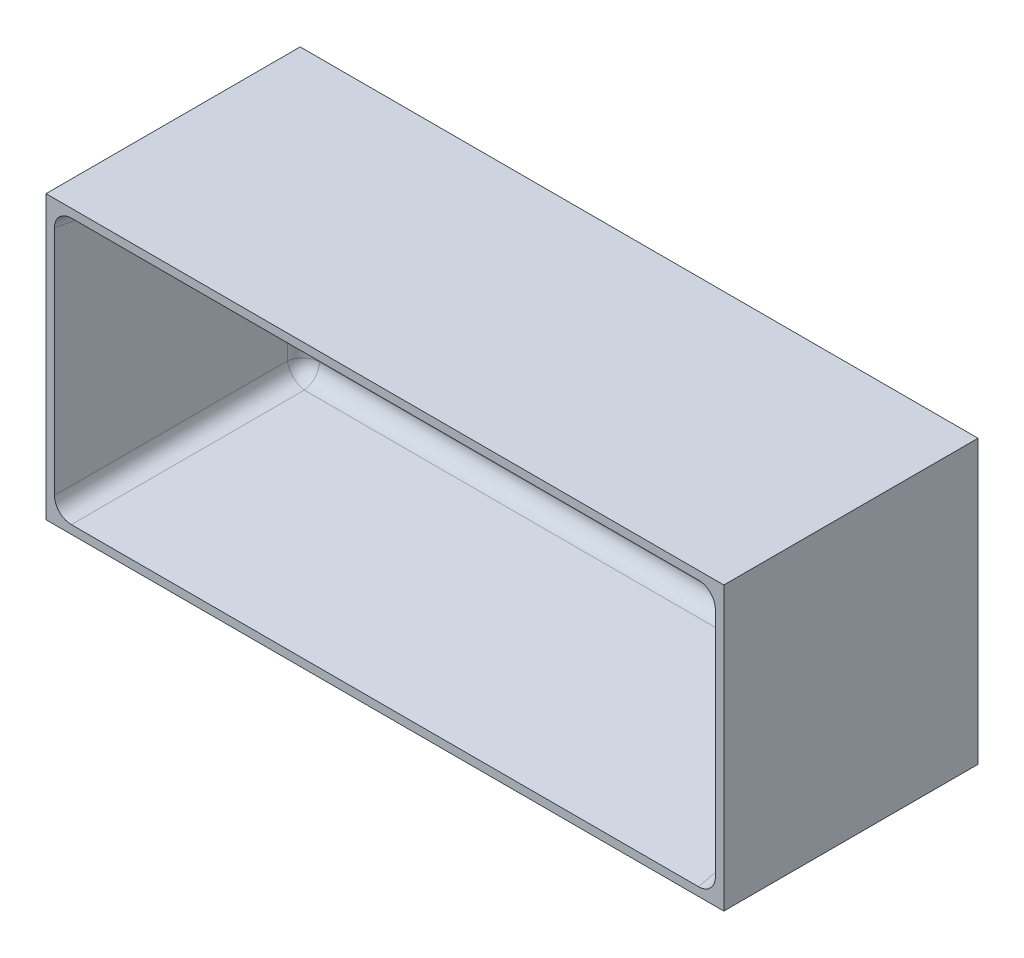
from build123d import *

# Parameters (mm, degrees)
SKETCH1_W           = 120
SKETCH1_H           = 50
BOSS_EXTRUDE1_DEPTH = 5
SKETCH2_W           = 120
SKETCH2_H           = 50
SKETCH2_W_2         = 117
SKETCH2_H_2         = 47
BOSS_EXTRUDE3_DEPTH = 40
DRAFT2_ANGLE        = 6
FILLET1_R           = 3


with BuildPart() as part:
    # Sketch1 → Boss-Extrude1 (new body)
    with BuildSketch(Plane.XY):
        Rectangle(SKETCH1_W, SKETCH1_H)
    extrude(amount=BOSS_EXTRUDE1_DEPTH)

    # Sketch2 → Boss-Extrude3 (add)
    with BuildSketch(Plane.XY.offset(5)):
        Rectangle(SKETCH2_W, SKETCH2_H)
        Rectangle(SKETCH2_W_2, SKETCH2_H_2, mode=Mode.SUBTRACT)
    extrude(amount=BOSS_EXTRUDE3_DEPTH)

    # Draft2
    draft2_faces = [part.faces().sort_by_distance(p)[0] for p in [
        (-58.5, 0, 25),
        (0, 23.5, 25),
        (58.5, 0, 25),
        (0, -23.5, 25),
    ]]
    draft(draft2_faces, Plane.XY.offset(45), DRAFT2_ANGLE)

    # Fillet1
    fillet1_edges = [part.edges().sort_by_distance(p)[0] for p in [
        (54.295830589, 0, 5),
        (0, 19.295830589, 5),
        (-54.295830589, 0, 5),
        (0, -19.295830589, 5),
        (56.397915295, 21.397915295, 25),
        (-56.397915295, 21.397915295, 25),
        (-56.397915295, -21.397915295, 25),
        (56.397915295, -21.397915295, 25),
    ]]
    fillet(fillet1_edges, radius=FILLET1_R)


solid = part.part
